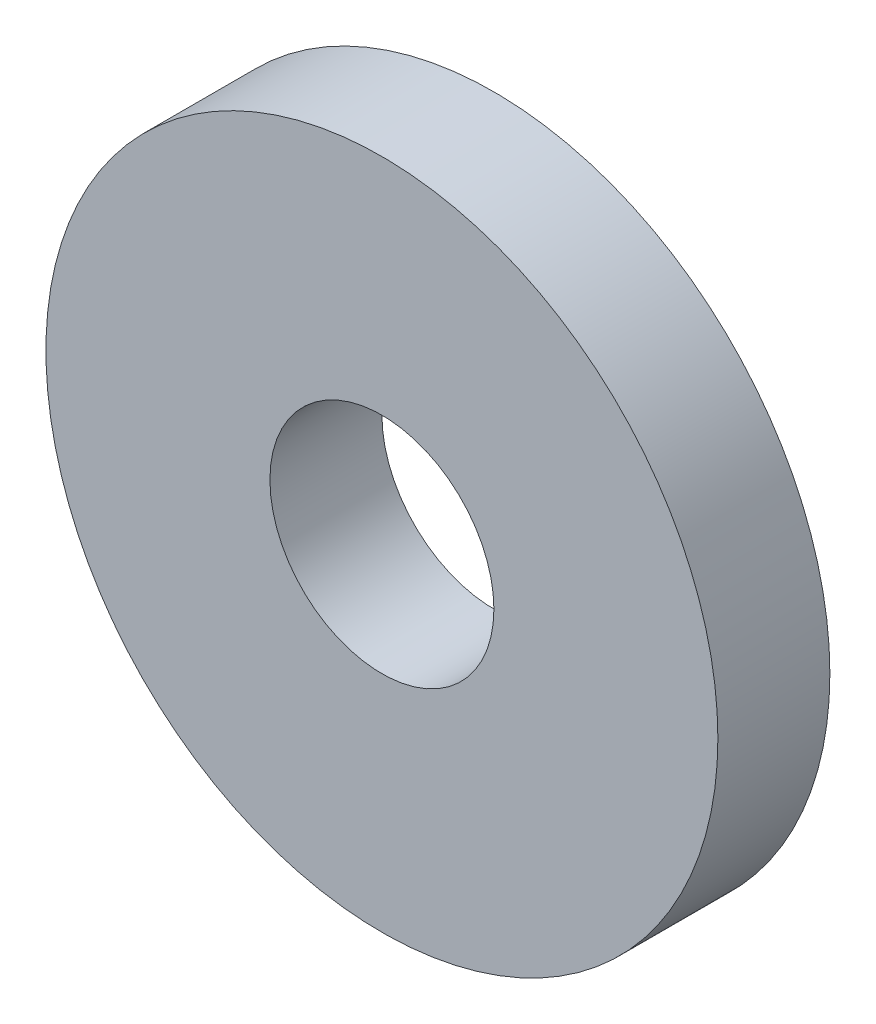
from build123d import *

# Parameters (mm, degrees)
SKETCH_1_R          = 3
EXTRUDE_1_DEPTH     = 1
SKETCH_3_R          = 1
CUT_EXTRUDE_1_DEPTH = 5.358898944


with BuildPart() as part:
    # 草图1 → 凸台-拉伸1 (new body)
    with BuildSketch(Plane.XY):
        Circle(SKETCH_1_R)
    extrude(amount=EXTRUDE_1_DEPTH)

    # 草图2 → 切除-旋转1 (revolve, cut)
    with BuildSketch(Plane(origin=(0, 0, 0), x_dir=(1, 0, 0), z_dir=(0, 1, 0))):
        with BuildLine():
            Line((1.5, 0), (2.5, 0))
            ThreePointArc((2.5, 0), (2, -0.5), (1.5, 0))
        make_face()
    revolve(axis=Axis((0, 0, 1), (0, 0, -1)), mode=Mode.SUBTRACT)

    # 草图3 → 切除-拉伸1 (cut, through all)
    with BuildSketch(Plane(origin=(0, 0, 0), x_dir=(-1, 0, 0), z_dir=(0, 0, -1))):
        Circle(SKETCH_3_R)
    extrude(amount=-CUT_EXTRUDE_1_DEPTH, mode=Mode.SUBTRACT)


solid = part.part
